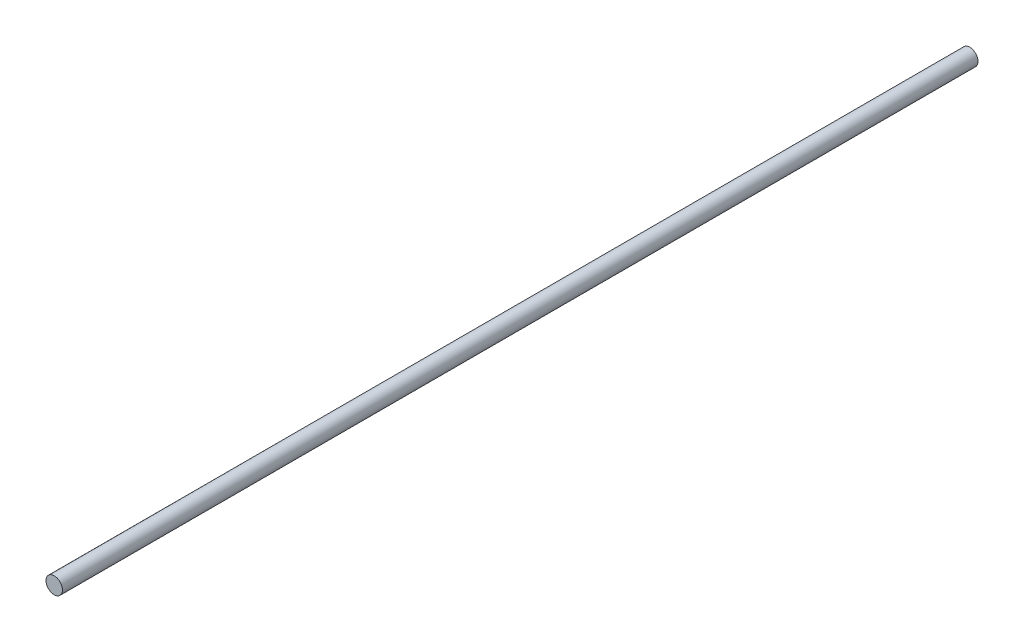
from build123d import *

# Parameters (mm, degrees)
SKETCH1_R           = 4
BOSS_EXTRUDE1_DEPTH = 445


with BuildPart() as part:
    # Sketch1 → Boss-Extrude1 (new body)
    with BuildSketch(Plane.XY):
        Circle(SKETCH1_R)
    extrude(amount=BOSS_EXTRUDE1_DEPTH)


solid = part.part
